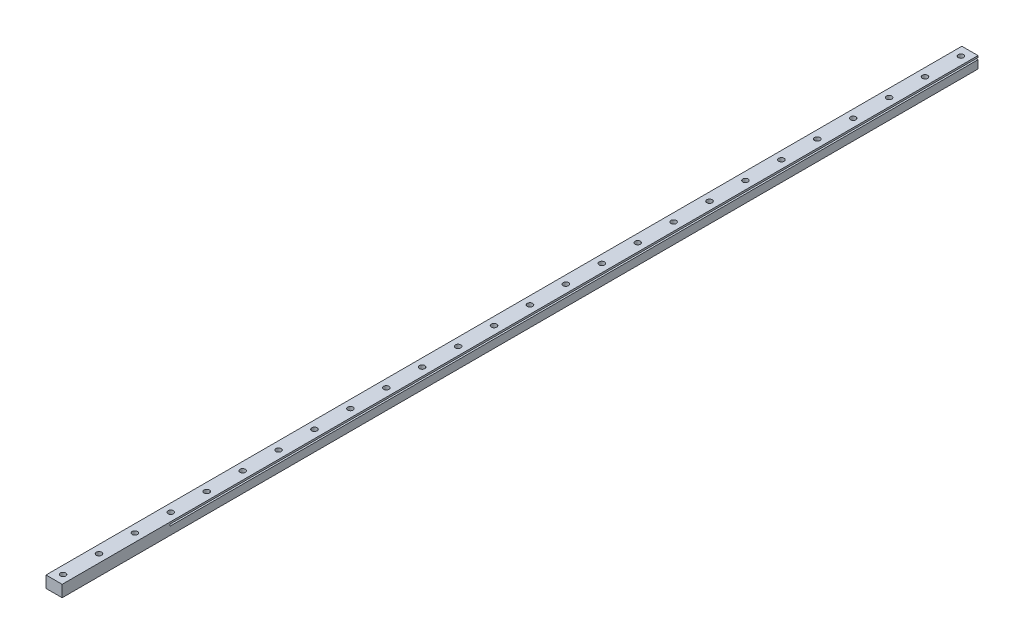
from build123d import *

# Parameters (mm, degrees)
SKETCH_1_W          = 9
SKETCH_1_H          = 6.5
EXTRUDE_1_DEPTH     = 510
SKETCH_2_W          = 2
SKETCH_2_H          = 1
CUT_EXTRUDE_1_DEPTH = 450
SKETCH_3_R          = 1.5
CUT_EXTRUDE_2_DEPTH = 6.5


with BuildPart() as part:
    # 草图1 → 凸台-拉伸1 (new body)
    with BuildSketch(Plane.XY):
        with Locations((-4.5, 3.25)):
            Rectangle(SKETCH_1_W, SKETCH_1_H)
    extrude(amount=EXTRUDE_1_DEPTH)

    # 草图2 → 切除-拉伸1 (cut)
    with BuildSketch(Plane(origin=(0, 0, 0), x_dir=(-1, 0, 0), z_dir=(0, 0, -1))):
        with Locations((1, 5)):
            Rectangle(SKETCH_2_W, SKETCH_2_H)
        with Locations((8, 5)):
            Rectangle(SKETCH_2_W, SKETCH_2_H)
    extrude(amount=-CUT_EXTRUDE_1_DEPTH, mode=Mode.SUBTRACT)

    # 草图3 → 切除-拉伸2 (cut)
    with BuildSketch(Plane(origin=(0, 6.5, 0), x_dir=(1, 0, 0), z_dir=(0, 1, 0))):
        with Locations(Location((-4.5, -5, 0), (0, 0, 180))):
            Circle(SKETCH_3_R)
        with Locations(Location((-4.5, -25, 0), (0, 0, 180))):
            Circle(SKETCH_3_R)
        with Locations(Location((-4.5, -45, 0), (0, 0, 180))):
            Circle(SKETCH_3_R)
        with Locations(Location((-4.5, -65, 0), (0, 0, 180))):
            Circle(SKETCH_3_R)
        with Locations(Location((-4.5, -85, 0), (0, 0, 180))):
            Circle(SKETCH_3_R)
        with Locations(Location((-4.5, -105, 0), (0, 0, 180))):
            Circle(SKETCH_3_R)
        with Locations(Location((-4.5, -125, 0), (0, 0, 180))):
            Circle(SKETCH_3_R)
        with Locations(Location((-4.5, -145, 0), (0, 0, 180))):
            Circle(SKETCH_3_R)
        with Locations(Location((-4.5, -165, 0), (0, 0, 180))):
            Circle(SKETCH_3_R)
        with Locations(Location((-4.5, -185, 0), (0, 0, 180))):
            Circle(SKETCH_3_R)
        with Locations(Location((-4.5, -205, 0), (0, 0, 180))):
            Circle(SKETCH_3_R)
        with Locations(Location((-4.5, -225, 0), (0, 0, 180))):
            Circle(SKETCH_3_R)
        with Locations(Location((-4.5, -245, 0), (0, 0, 180))):
            Circle(SKETCH_3_R)
        with Locations(Location((-4.5, -265, 0), (0, 0, 180))):
            Circle(SKETCH_3_R)
        with Locations(Location((-4.5, -285, 0), (0, 0, 180))):
            Circle(SKETCH_3_R)
        with Locations(Location((-4.5, -305, 0), (0, 0, 180))):
            Circle(SKETCH_3_R)
        with Locations(Location((-4.5, -325, 0), (0, 0, 180))):
            Circle(SKETCH_3_R)
        with Locations(Location((-4.5, -345, 0), (0, 0, 180))):
            Circle(SKETCH_3_R)
        with Locations(Location((-4.5, -365, 0), (0, 0, 180))):
            Circle(SKETCH_3_R)
        with Locations(Location((-4.5, -385, 0), (0, 0, 180))):
            Circle(SKETCH_3_R)
        with Locations(Location((-4.5, -405, 0), (0, 0, 180))):
            Circle(SKETCH_3_R)
        with Locations(Location((-4.5, -425, 0), (0, 0, 180))):
            Circle(SKETCH_3_R)
        with Locations(Location((-4.5, -445, 0), (0, 0, 180))):
            Circle(SKETCH_3_R)
        with Locations(Location((-4.5, -465, 0), (0, 0, 180))):
            Circle(SKETCH_3_R)
        with Locations(Location((-4.5, -485, 0), (0, 0, 180))):
            Circle(SKETCH_3_R)
        with Locations(Location((-4.5, -505, 0), (0, 0, 180))):
            Circle(SKETCH_3_R)
    extrude(amount=-CUT_EXTRUDE_2_DEPTH, mode=Mode.SUBTRACT)


solid = part.part
